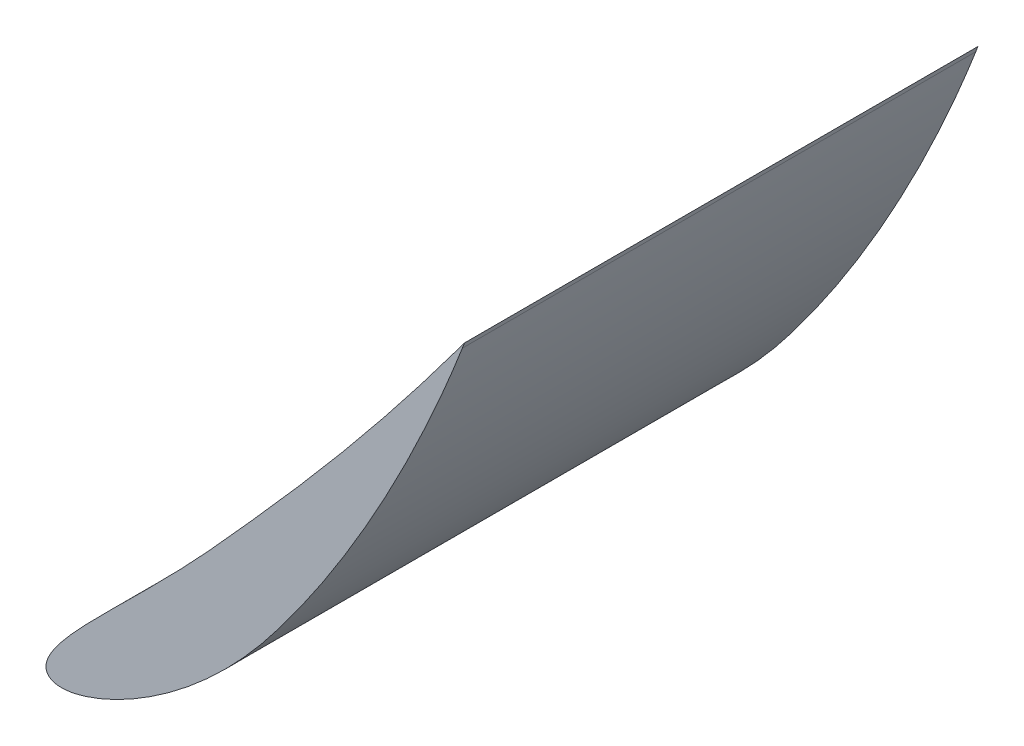
from build123d import *

# Parameters (mm, degrees)
BOSS_EXTRUDE1_DEPTH = 101.6


with BuildPart() as part:
    # Sketch1 → Boss-Extrude1 (new body)
    with BuildSketch(Plane.XY):
        with BuildLine():
            Line((81.511444345, 97.390502859), (82.192739914, 98.308581554))
            Line((82.192739914, 98.308581554), (81.756608516, 97.184785693))
            add(Edge.make_bspline(
                [(81.756608516, 97.184785693), (81.7316792, 97.120549407), (81.632132094, 96.864042707), (81.407728169, 96.289171862), (81.033364945, 95.336716476), (80.507503011, 94.015604068), (79.829046021, 92.337613031), (78.996516853, 90.317819192), (78.008599211, 87.973973912), (76.864331348, 85.326520379), (75.563174618, 82.39805106), (74.104950584, 79.213406752), (72.491153275, 75.798643231), (70.723434587, 72.181630378), (68.804632505, 68.391355066), (66.739420351, 64.457353705), (64.53292164, 60.410126963), (62.192043894, 56.280367272), (59.724417975, 52.099067648), (57.139117435, 47.897266554), (54.447104012, 43.705001834), (51.659263969, 39.552845289), (48.789366546, 35.46928923), (45.849089841, 31.48469842), (42.863736697, 27.617649803), (39.779157596, 23.949002752), (36.622650342, 20.498375873), (33.418257647, 17.283094467), (30.193205578, 14.316986172), (26.976711981, 11.610483674), (23.799330275, 9.171404815), (20.693176479, 7.004043577), (17.690445546, 5.110776501), (14.82369285, 3.490992148), (12.124631562, 2.142346626), (9.623196915, 1.061312858), (7.347446905, 0.242219484), (5.321498885, -0.32005744), (3.565123614, -0.632851232), (2.08995471, -0.700909761), (0.896547455, -0.525082578), (-0.013401143, -0.081804136), (-0.579008282, 0.660655586), (-0.68861093, 1.632061937), (-0.413303285, 2.742883288), (0.196818824, 4.028541279), (1.137954116, 5.503123048), (2.400612688, 7.170375486), (3.971801237, 9.029076404), (5.833978608, 11.076265304), (7.966452508, 13.308114525), (10.344710675, 15.720915973), (12.942739442, 18.309610481), (15.731420305, 21.06951334), (18.680606539, 23.99459195), (21.758461338, 27.078400751), (24.932967555, 30.312956499), (28.171651177, 33.689144273), (31.44370548, 37.195619401), (34.715133181, 40.822905715), (38.026882626, 44.494241162), (41.344254262, 48.200989973), (44.645184927, 51.921549282), (47.904878915, 55.636785789), (51.101629595, 59.325019699), (54.214433494, 62.964747578), (57.224003935, 66.533442429), (60.113297002, 70.00792398), (62.865902949, 73.365523414), (65.46804394, 76.582875359), (67.906618257, 79.637639427), (70.17031171, 82.507877476), (72.248475631, 85.173105701), (74.132535455, 87.613424091), (75.813982201, 89.811085714), (77.286005583, 91.749677425), (78.542016882, 93.415033532), (79.577045247, 94.794663223), (80.38666345, 95.878355721), (80.967324011, 96.658293954), (81.316927502, 97.128382016), (81.472499349, 97.338022595), (81.511444345, 97.390502859)],
                knots=[0, 0, 0, 0, 0.000791305, 0.003159821, 0.007087067, 0.012544017, 0.019489361, 0.027872822, 0.037632601, 0.048699423, 0.060994432, 0.074433103, 0.088923206, 0.104367786, 0.120665388, 0.137709591, 0.15539151, 0.173600813, 0.192223028, 0.211145779, 0.230254002, 0.249435263, 0.268576885, 0.287568118, 0.306301322, 0.324670996, 0.34259499, 0.35999234, 0.376785861, 0.392898379, 0.408252229, 0.422771246, 0.436380025, 0.44900307, 0.460569968, 0.471014387, 0.480280085, 0.488325188, 0.49513273, 0.500728157, 0.50521737, 0.508862648, 0.512070109, 0.515470595, 0.519696371, 0.525078124, 0.531750336, 0.539754064, 0.549080127, 0.559691732, 0.571531153, 0.584527708, 0.598597801, 0.613649926, 0.62958577, 0.646300272, 0.663685555, 0.681632124, 0.700026867, 0.718761006, 0.737726751, 0.75680858, 0.775887894, 0.794846492, 0.813569043, 0.831939507, 0.849846884, 0.867180215, 0.883834326, 0.899707217, 0.914700572, 0.928722615, 0.941687172, 0.953513138, 0.964128061, 0.973465194, 0.981467029, 0.988082829, 0.993272151, 0.997001957, 0.999249486, 1, 1, 1, 1], degree=3))
        make_face()
    extrude(amount=BOSS_EXTRUDE1_DEPTH)


solid = part.part
